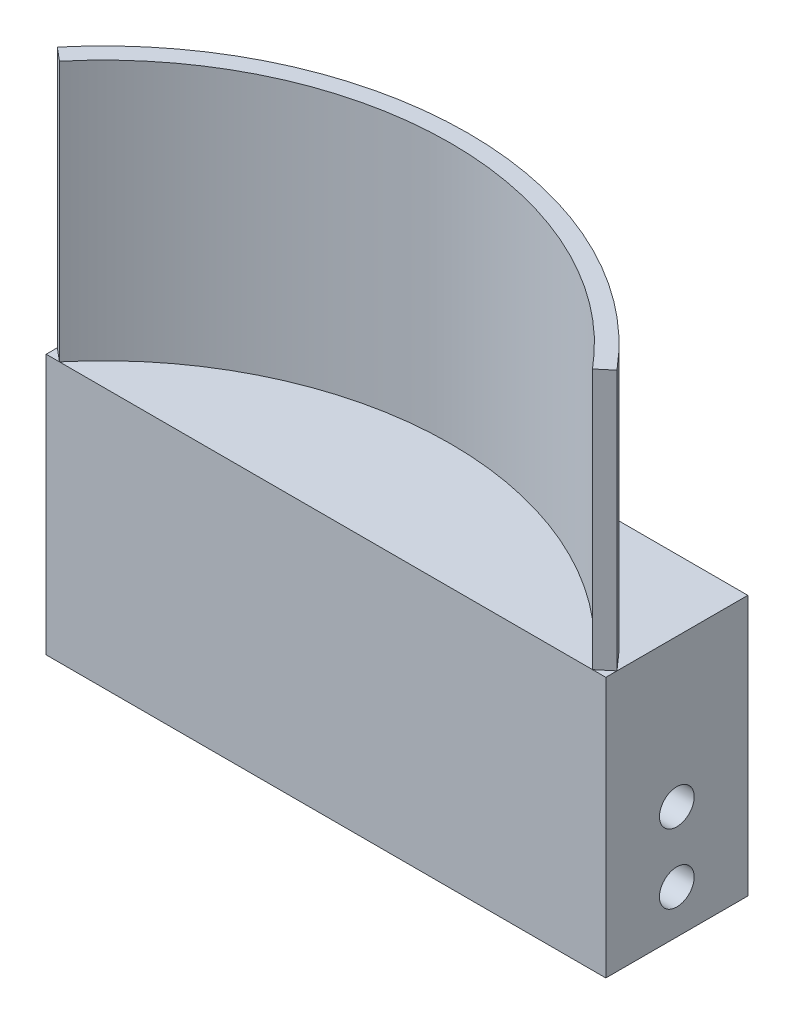
from build123d import *

# Parameters (mm, degrees)
BOSS_EXTRUDE1_DEPTH = 15
SKETCH3_W           = 32.23682377
SKETCH3_H           = 8.180060941
BOSS_EXTRUDE2_DEPTH = 15
SKETCH4_R           = 1
CUT_EXTRUDE1_DEPTH  = 15


with BuildPart() as part:
    # Sketch2 → Boss-Extrude1 (new body)
    with BuildSketch(Plane(origin=(0, 0, 0), x_dir=(1, 0, 0), z_dir=(0, 1, 0))):
        with BuildLine():
            Line((-16.118411885, 13.460936011), (-15.350868462, 12.819939059))
            ThreePointArc((-15.350868462, 12.819939059), (0, 20), (15.350868462, 12.819939059))
            Line((15.350868462, 12.819939059), (16.118411885, 13.460936011))
            ThreePointArc((16.118411885, 13.460936011), (0, 21), (-16.118411885, 13.460936011))
        make_face()
    extrude(amount=BOSS_EXTRUDE1_DEPTH)

    # Sketch3 → Boss-Extrude2 (add)
    with BuildSketch(Plane.XZ):
        with Locations((0, -16.909969529)):
            Rectangle(SKETCH3_W, SKETCH3_H)
    extrude(amount=BOSS_EXTRUDE2_DEPTH)

    # Sketch4 → Cut-Extrude1 (cut)
    with BuildSketch(Plane(origin=(16.118411885, 0, 0), x_dir=(0, 0, -1), z_dir=(1, 0, 0))):
        with Locations((16.909969529, -12.5)):
            Circle(SKETCH4_R)
        with Locations((16.909969529, -8.5)):
            Circle(SKETCH4_R)
    extrude(amount=-CUT_EXTRUDE1_DEPTH, mode=Mode.SUBTRACT)


solid = part.part
